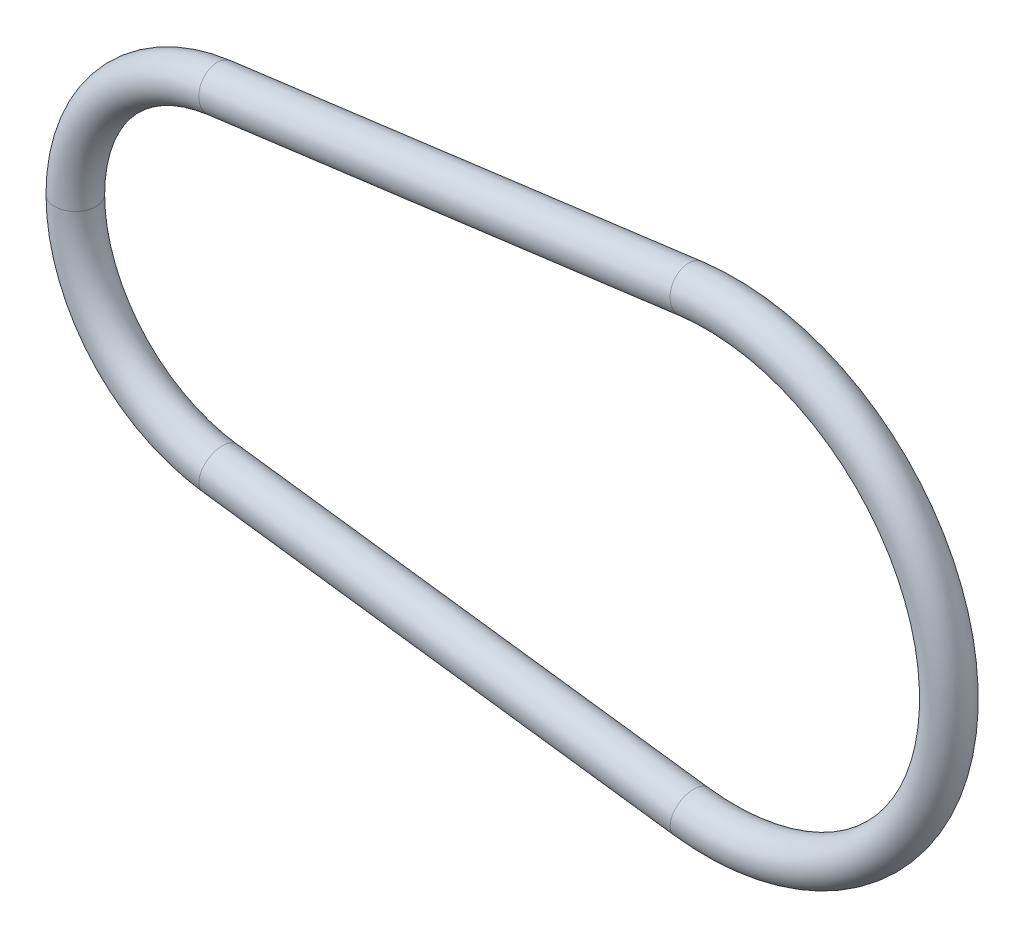
from build123d import *

# Parameters (mm, degrees)
SKETCH3_R = 2


with BuildPart() as part:
    # Sweep1: sweep along a path in Sketch2
    with BuildLine(Plane.XY) as sweep1_path:
        Line((-2.077697888, 15.864525568), (43.348150524, 21.813722655))
        ThreePointArc((43.348150524, 21.813722655), (68.20498512, 0), (43.348150524, -21.813722655))
        Line((43.348150524, -21.813722655), (-2.077697888, -15.864525568))
        ThreePointArc((-2.077697888, -15.864525568), (-16, 0), (-2.077697888, 15.864525568))
    # Sketch3 → Sweep1 (sweep)
    with BuildSketch(Plane(origin=(0, 0, 0), x_dir=(1, 0, 0), z_dir=(0, 1, 0))):
        with Locations((-16, 0)):
            Circle(SKETCH3_R)
    sweep(path=sweep1_path.line)


solid = part.part
